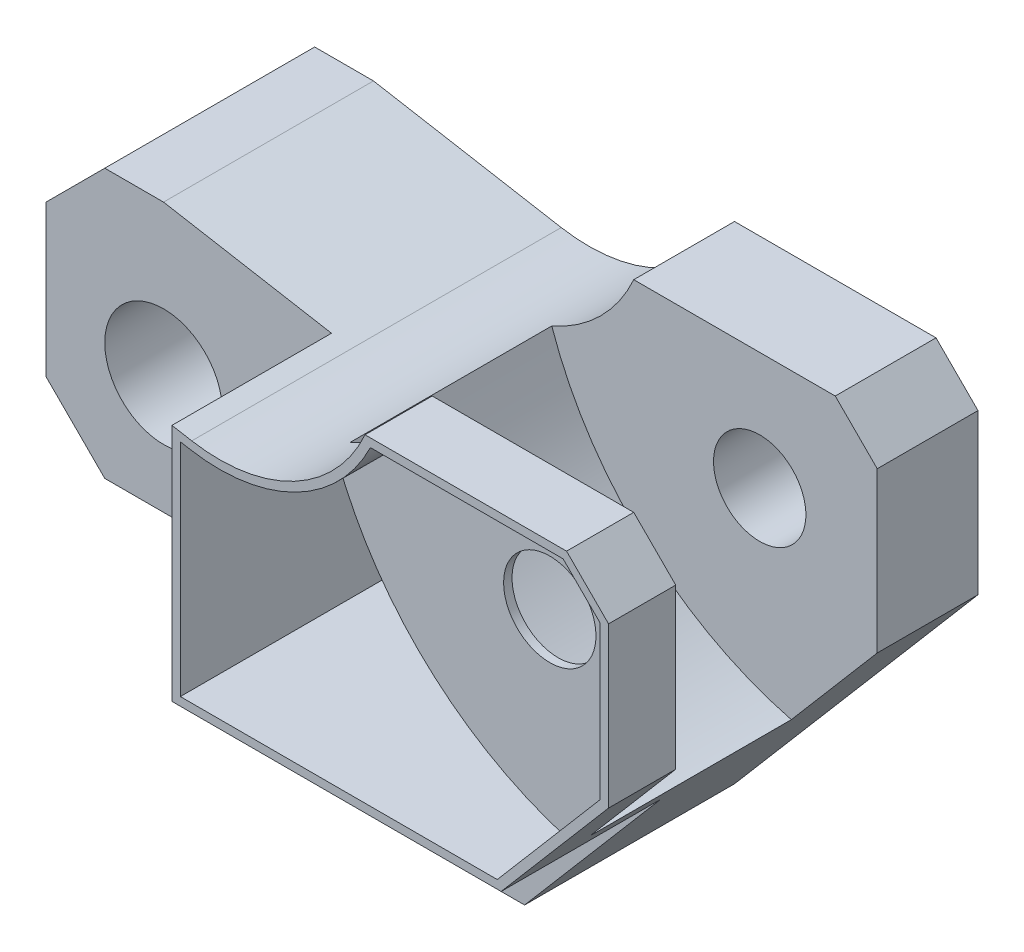
from build123d import *

# Parameters (mm, degrees)
ESQUISSE1_R             = 7
ESQUISSE1_R_2           = 5.5
BOSS_EXTRU_1_DEPTH      = 44
CHANFREIN1_SIZE         = 7
CHANFREIN2_SIZE         = 5
ESQUISSE2_W             = 34
ESQUISSE2_H             = 19
ENL_V_MAT_EXTRU_1_DEPTH = 103.391405889
ESQUISSE4_W             = 19
ESQUISSE4_H             = 19
ENL_V_MAT_EXTRU_2_DEPTH = 103.08329932
ENL_V_START             = -12
ENL_V_MAT_EXTRU_3_DEPTH = 24
ENL_V_MAT_EXTRU_4_DEPTH = 7
ENL_V_MAT_EXTRU_5_DEPTH = 25


with BuildPart() as part:
    # Esquisse1 → Boss.-Extru.1 (new body)
    with BuildSketch(Plane.XY):
        with BuildLine():
            Line((-14, 18), (0, 18))
            Line((0, 18), (22.361380836, 14.057085233))
            ThreePointArc((22.361380836, 14.057085233), (34.561098706, 15.982044142), (43, 25))
            Line((43, 25), (67, 25))
            Line((67, 25), (72, 25))
            Line((72, 25), (72, 1))
            Line((72, 1), (43, -33))
            Line((43, -33), (37.296980053, -33))
            ThreePointArc((37.296980053, -33), (32.858007856, -26.115672061), (30.521177653, -18.264705882))
            ThreePointArc((30.521177653, -18.264705882), (28.840774692, -15.213413768), (25.575538911, -14))
            Line((25.575538911, -14), (-14, -14))
            Line((-14, -14), (-14, 18))
        make_face()
        Circle(ESQUISSE1_R, mode=Mode.SUBTRACT)
        with Locations((58, 11)):
            Circle(ESQUISSE1_R_2, mode=Mode.SUBTRACT)
    extrude(amount=BOSS_EXTRU_1_DEPTH)

    # Chanfrein1
    chanfrein1_edges = [part.edges().sort_by_distance(p)[0] for p in [
        (-14, -14, 22),
        (-14, 18, 22),
    ]]
    chamfer(chanfrein1_edges, length=CHANFREIN1_SIZE)

    # Chanfrein2
    chanfrein2_edges = [part.edges().sort_by_distance(p)[0] for p in [
        (72, 25, 22),
    ]]
    chamfer(chanfrein2_edges, length=CHANFREIN2_SIZE)

    # Esquisse2 → Enlèv. mat.-Extru.1 (cut, through all)
    with BuildSketch(Plane(origin=(0, 25, 0), x_dir=(1, 0, 0), z_dir=(0, 1, 0))):
        with Locations((3, -34.5)):
            Rectangle(ESQUISSE2_W, ESQUISSE2_H)
    extrude(amount=-ENL_V_MAT_EXTRU_1_DEPTH, mode=Mode.SUBTRACT)

    # Esquisse4 → Enlèv. mat.-Extru.2 (cut, through all)
    with BuildSketch(Plane(origin=(72, 0, 0), x_dir=(0, 0, -1), z_dir=(1, 0, 0))):
        with Locations((-34.5, -23.5)):
            Rectangle(ESQUISSE4_W, ESQUISSE4_H)
    extrude(amount=-ENL_V_MAT_EXTRU_2_DEPTH, mode=Mode.SUBTRACT)

    # Esquisse5 → Enlèv. mat.-Extru.3 (cut)
    with BuildSketch(Plane(origin=(0, 0, 0), x_dir=(-1, 0, 0), z_dir=(0, 0, -1)).offset(ENL_V_START)):
        with BuildLine():
            Line((-43, 25), (-67, 25))
            Line((-67, 25), (-72, 20))
            Line((-72, 20), (-72, 1))
            Line((-72, 1), (-61.764705882, -11))
            ThreePointArc((-61.764705882, -11), (-44.184262982, -1.419294771), (-33.236936549, 15.344294617))
            ThreePointArc((-33.236936549, 15.344294617), (-39.021244343, 19.259333621), (-43, 25))
        make_face()
    extrude(amount=-ENL_V_MAT_EXTRU_3_DEPTH, mode=Mode.SUBTRACT)

    # Esquisse7 → Enlèv. mat.-Extru.4 (cut)
    with BuildSketch(Plane.XY.offset(44)):
        with BuildLine():
            Line((21, -13), (58.744476296, -13))
            Line((58.744476296, -13), (71, 1.368545033))
            Line((71, 1.368545033), (71, 19.585786438))
            Line((71, 19.585786438), (66.585786438, 24))
            Line((66.585786438, 24), (43.636084685, 24))
            ThreePointArc((43.636084685, 24), (34.740005768, 14.948047079), (22.187732658, 13.07227748))
            Line((22.187732658, 13.07227748), (21, 13.281706793))
            Line((21, 13.281706793), (21, -13))
        make_face()
    extrude(amount=-ENL_V_MAT_EXTRU_4_DEPTH, mode=Mode.SUBTRACT)

    # Esquisse8 → Enlèv. mat.-Extru.5 (cut)
    with BuildSketch(Plane.XY.offset(37)):
        with BuildLine():
            Line((21, 13.281706793), (21, -13))
            Line((21, -13), (58.744476296, -13))
            Line((58.744476296, -13), (59.986847747, -11.543426575))
            ThreePointArc((59.986847747, -11.543426575), (43.310181683, -1.972127362), (32.646682943, 14.028208705))
            ThreePointArc((32.646682943, 14.028208705), (27.481076416, 12.851449437), (22.187732658, 13.07227748))
            Line((22.187732658, 13.07227748), (21, 13.281706793))
        make_face()
    extrude(amount=-ENL_V_MAT_EXTRU_5_DEPTH, mode=Mode.SUBTRACT)


solid = part.part
